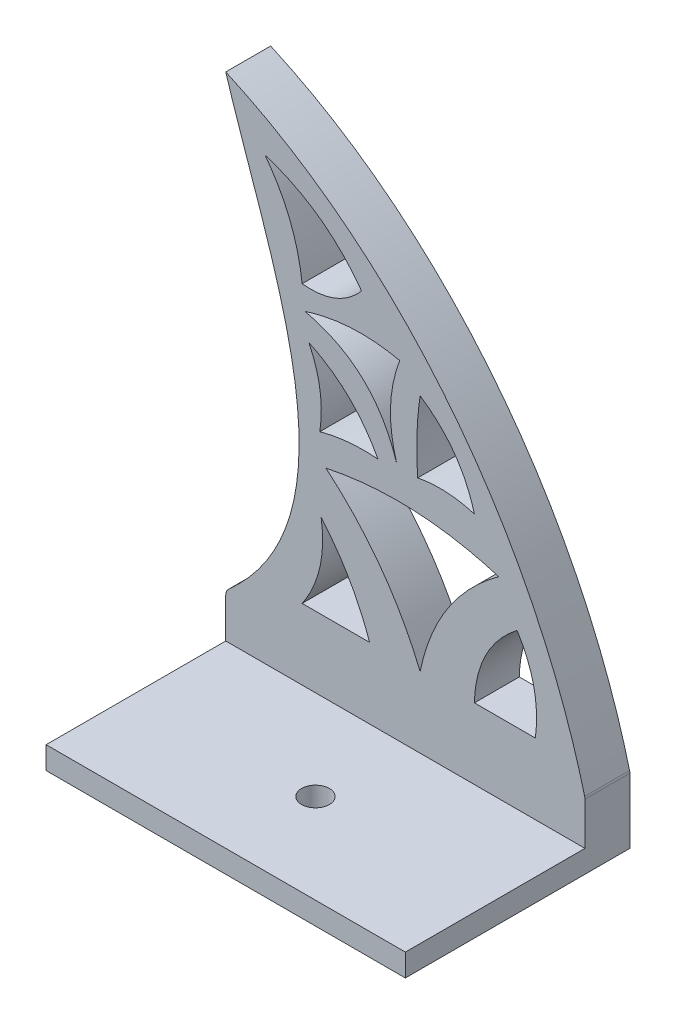
from build123d import *

# Parameters (mm, degrees)
SKETCH1_W           = 101.6
SKETCH1_H           = 152.4
BOSS_EXTRUDE1_DEPTH = 12.7
BOSS_EXTRUDE3_DEPTH = 12.7
FILLET1_R           = 2.54
FILLET2_R           = 5.08
CUT_EXTRUDE2_DEPTH  = 298.570512784
SKETCH8_W           = 101.6
SKETCH8_H           = 6.35
BOSS_EXTRUDE4_DEPTH = 50.8
SKETCH9_R           = 3.937
CUT_EXTRUDE3_DEPTH  = 184.802308472


with BuildPart() as part:
    # Sketch1 → Boss-Extrude1 (new body)
    with BuildSketch(Plane.XY):
        with Locations((50.8, 76.2)):
            Rectangle(SKETCH1_W, SKETCH1_H)
    extrude(amount=BOSS_EXTRUDE1_DEPTH)

    # Sketch2 → Boss-Extrude3 (add)
    with BuildSketch(Plane.XY):
        with BuildLine():
            add(Edge.make_bspline(
                [(0, 152.4), (39.790111277, 186.839065643), (12.30975625, 238.845497073), (0, 279.4)],
                knots=[0, 0, 0, 0, 1, 1, 1, 1], degree=3))
            add(Edge.make_bspline(
                [(0, 279.4), (51.286050257, 256.550041835), (87.836892382, 205.957944637), (101.6, 152.4)],
                knots=[0, 0, 0, 0, 1, 1, 1, 1], degree=3))
            Line((101.6, 152.4), (0, 152.4))
        make_face()
        with BuildLine():
            add(Edge.make_bspline(
                [(49.225838487, 233.315766274), (35.641228944, 236.267866949), (22.375615267, 231.937259722)],
                knots=[0, 0, 0, 1, 1, 1], degree=2))
            add(Edge.make_bspline(
                [(48.400350721, 207.535437601), (42.054170901, 227.566198031), (22.375615267, 231.937259722)],
                knots=[0, 0, 0, 1, 1, 1], degree=2))
            add(Edge.make_bspline(
                [(48.400350721, 207.535437601), (44.393568943, 220.734513873), (49.225838487, 233.315766274)],
                knots=[0, 0, 0, 1, 1, 1], degree=2))
        make_face(mode=Mode.SUBTRACT)
        with BuildLine():
            add(Edge.make_bspline(
                [(43.05348098, 206.08803494), (36.239789994, 218.91266054), (23.516066372, 224.861937296)],
                knots=[0, 0, 0, 1, 1, 1], degree=2))
            add(Edge.make_bspline(
                [(23.516066372, 224.861937296), (28.235295407, 215.21927262), (26.605728117, 204.582177714)],
                knots=[0, 0, 0, 1, 1, 1], degree=2))
            add(Edge.make_bspline(
                [(26.605728117, 204.582177714), (34.700432609, 206.792891754), (43.05348098, 206.08803494)],
                knots=[0, 0, 0, 1, 1, 1], degree=2))
        make_face(mode=Mode.SUBTRACT)
        with BuildLine():
            add(Edge.make_bspline(
                [(82.396089655, 183.81371778), (70.6713649, 174.663598784), (70.32777317, 160.02)],
                knots=[0, 0, 0, 1, 1, 1], degree=2))
            Line((70.32777317, 160.02), (87.546521436, 160.02))
            add(Edge.make_bspline(
                [(82.396089655, 183.81371778), (89.339550367, 172.773814043), (87.546521436, 160.02)],
                knots=[0, 0, 0, 1, 1, 1], degree=2))
        make_face(mode=Mode.SUBTRACT)
        with BuildLine():
            add(Edge.make_bspline(
                [(26.980466376, 183.81374211), (28.958775605, 170.837543608), (21.602944743, 160.02)],
                knots=[0, 0, 0, 1, 1, 1], degree=2))
            Line((21.602944743, 160.02), (40.676641776, 160.02))
            add(Edge.make_bspline(
                [(26.980466376, 183.81374211), (36.13847285, 173.175056715), (40.676641776, 160.02)],
                knots=[0, 0, 0, 1, 1, 1], degree=2))
        make_face(mode=Mode.SUBTRACT)
        with BuildLine():
            add(Edge.make_bspline(
                [(54.97708308, 160.02), (46.08347584, 181.54755316), (28.342136903, 196.529802482)],
                knots=[0, 0, 0, 1, 1, 1], degree=2))
            add(Edge.make_bspline(
                [(28.342136903, 196.529802482), (53.017815002, 201.732288521), (77.187204495, 194.363538628)],
                knots=[0, 0, 0, 1, 1, 1], degree=2))
            add(Edge.make_bspline(
                [(54.97708308, 160.02), (59.374728895, 181.400643158), (77.187204495, 194.363538628)],
                knots=[0, 0, 0, 1, 1, 1], degree=2))
        make_face(mode=Mode.SUBTRACT)
        with BuildLine():
            add(Edge.make_bspline(
                [(70.328259561, 206.277457578), (62.361576962, 208.669014941), (54.287141362, 207.109917469)],
                knots=[0, 0, 0, 1, 1, 1], degree=2))
            add(Edge.make_bspline(
                [(54.287141362, 207.109917469), (53.482096811, 217.391663167), (54.97708308, 227.557269012)],
                knots=[0, 0, 0, 1, 1, 1], degree=2))
            add(Edge.make_bspline(
                [(54.97708308, 227.557269012), (66.645859754, 219.852180834), (70.328259561, 206.277457578)],
                knots=[0, 0, 0, 1, 1, 1], degree=2))
        make_face(mode=Mode.SUBTRACT)
        with BuildLine():
            add(Edge.make_bspline(
                [(21.602944743, 238.323137826), (19.95197567, 252.974545225), (11.094737768, 264.601494061)],
                knots=[0, 0, 0, 1, 1, 1], degree=2))
            add(Edge.make_bspline(
                [(11.094737768, 264.601494061), (28.053835186, 259.295838115), (38.412267282, 244.949944056)],
                knots=[0, 0, 0, 1, 1, 1], degree=2))
            add(Edge.make_bspline(
                [(21.602944743, 238.323137826), (31.864782779, 237.284469605), (38.412267282, 244.949944056)],
                knots=[0, 0, 0, 1, 1, 1], degree=2))
        make_face(mode=Mode.SUBTRACT)
    extrude(amount=BOSS_EXTRUDE3_DEPTH)

    # Fillet1
    fillet1_edges = [part.edges().sort_by_distance(p)[0] for p in [
        (101.6, 152.4, 6.35),
        (0, 152.4, 6.35),
    ]]
    fillet(fillet1_edges, radius=FILLET1_R)

    # Fillet2
    fillet2_edges = [part.edges().sort_by_distance(p)[0] for p in [
        (0, 0, 6.35),
        (101.6, 0, 6.35),
    ]]
    fillet(fillet2_edges, radius=FILLET2_R)

    # Sketch5 → Cut-Extrude2 (cut, through all)
    with BuildSketch(Plane.XY.offset(12.7)):
        with BuildLine():
            Line((101.6, 133.663922723), (101.519048921, 133.663922723))
            Line((101.519048921, 133.663922723), (0, 133.663922723))
            Line((0, 133.663922723), (0, 5.08))
            ThreePointArc((0, 5.08), (1.487897552, 1.487897552), (5.08, 0))
            Line((5.08, 0), (96.52, 0))
            ThreePointArc((96.52, 0), (100.112102448, 1.487897552), (101.6, 5.08))
            Line((101.6, 5.08), (101.6, 133.663922723))
        make_face()
    extrude(amount=-CUT_EXTRUDE2_DEPTH, mode=Mode.SUBTRACT)

    # Sketch8 → Boss-Extrude4 (add)
    with BuildSketch(Plane.XY.offset(12.7)):
        with Locations((50.8, 136.838922723)):
            Rectangle(SKETCH8_W, SKETCH8_H)
    extrude(amount=BOSS_EXTRUDE4_DEPTH)

    # Sketch9 → Cut-Extrude3 (cut, through all)
    with BuildSketch(Plane(origin=(0, 140.013922723, 0), x_dir=(1, 0, 0), z_dir=(0, 1, 0))):
        with Locations(Location((50.77976223, -38.1, 0), (0, 0, 270))):
            Circle(SKETCH9_R)
    extrude(amount=-CUT_EXTRUDE3_DEPTH, mode=Mode.SUBTRACT)


solid = part.part
